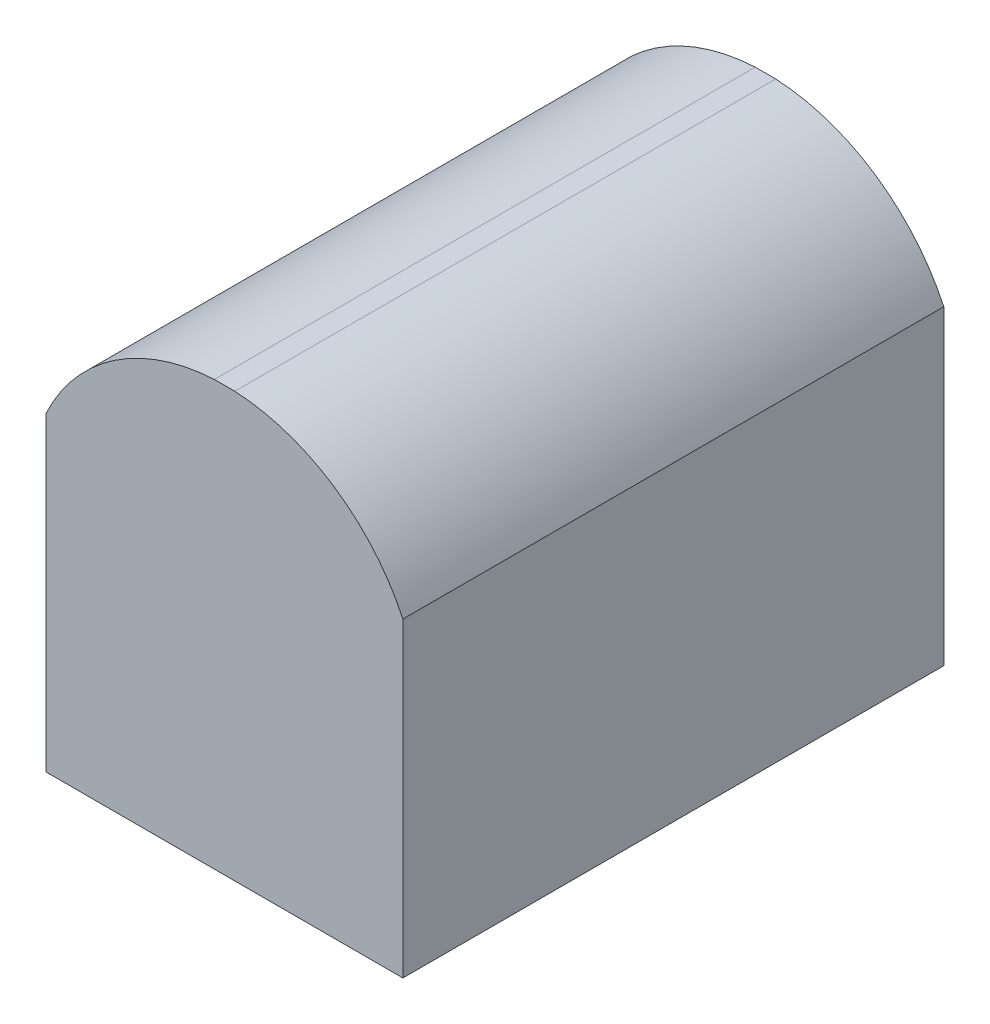
from build123d import *

# Parameters (mm, degrees)
BOSS_EXTRUDE1_DEPTH = 4.19862


with BuildPart() as part:
    # Sketch1 → Boss-Extrude1 (new body)
    with BuildSketch(Plane.XY):
        with BuildLine():
            Line((-10.492970574, 7.163426588), (-7.724370574, 7.163426588))
            Line((-7.724370574, 7.163426588), (-7.724370574, 9.576426588))
            ThreePointArc((-7.724370574, 9.576426588), (-8.254996592, 10.196572098), (-9.029123261, 10.455168937))
            Line((-9.029123261, 10.455168937), (-9.188217888, 10.455168937))
            ThreePointArc((-9.188217888, 10.455168937), (-9.962344557, 10.196572098), (-10.492970574, 9.576426588))
            Line((-10.492970574, 9.576426588), (-10.492970574, 7.163426588))
        make_face()
    extrude(amount=BOSS_EXTRUDE1_DEPTH)


solid = part.part
